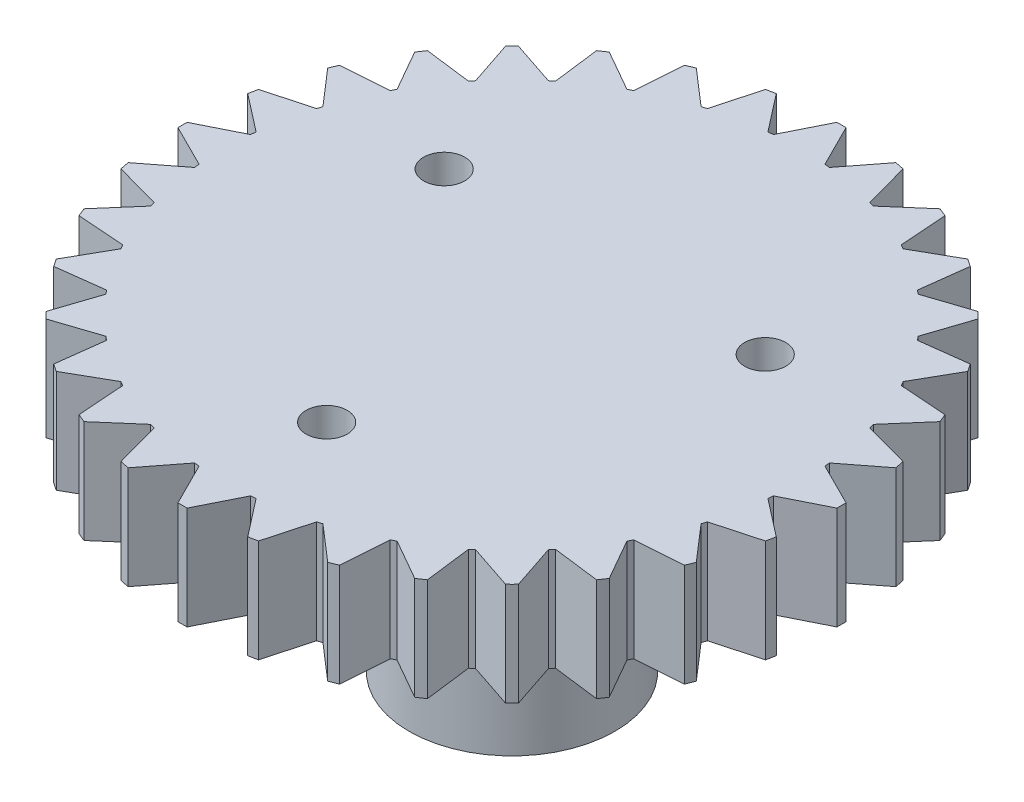
from build123d import *

# Parameters (mm, degrees)
BOSS_EXTRUDE1_DEPTH = 6.35
SKETCH2_OUTSIDE_W   = 55.65
SKETCH2_OUTSIDE_H   = 55.65
SKETCH2_OUTSIDE_R   = 20.32
CUT_EXTRUDE1_DEPTH  = 31.209342606
SKETCH3_R           = 6.35
BOSS_EXTRUDE2_DEPTH = 12.7
CUT_EXTRUDE3_DEPTH  = 2.54
SKETCH7_R           = 1.27
CUT_EXTRUDE4_DEPTH  = 33.527871126
CIRPATTERN2_COUNT   = 3


with BuildPart() as part:
    # Sketch1 → Boss-Extrude1 (new body)
    with BuildSketch(Plane(origin=(0, 0, 0), x_dir=(1, 0, 0), z_dir=(0, 1, 0))):
        with BuildLine():
            Line((0, 20.883987655), (1.5875, 17.708987655))
            ThreePointArc((1.5875, 17.708987655), (1.742744755, 17.69438444), (1.897855471, 17.678420309))
            Line((1.897855471, 17.678420309), (4.074263877, 20.482707688))
            Line((4.074263877, 20.482707688), (5.011848737, 17.059008536))
            ThreePointArc((5.011848737, 17.059008536), (5.161261562, 17.014399169), (5.310277422, 16.968481184))
            Line((5.310277422, 16.968481184), (7.991956077, 19.294288751))
            Line((7.991956077, 19.294288751), (8.243594937, 15.753461287))
            ThreePointArc((8.243594937, 15.753461287), (8.381433981, 15.68056008), (8.518628388, 15.606452844))
            Line((8.518628388, 15.606452844), (11.602521888, 17.364401118))
            Line((11.602521888, 17.364401118), (11.158544407, 13.842517355))
            ThreePointArc((11.158544407, 13.842517355), (11.279512592, 13.744125861), (11.399613243, 13.644677274))
            Line((11.399613243, 13.644677274), (14.767209289, 14.767209289))
            Line((14.767209289, 14.767209289), (13.644677274, 11.399613243))
            ThreePointArc((13.644677274, 11.399613243), (13.744125861, 11.279512592), (13.842517355, 11.158544407))
            Line((13.842517355, 11.158544407), (17.364401118, 11.602521888))
            Line((17.364401118, 11.602521888), (15.606452844, 8.518628388))
            ThreePointArc((15.606452844, 8.518628388), (15.68056008, 8.381433981), (15.753461287, 8.243594937))
            Line((15.753461287, 8.243594937), (19.294288751, 7.991956077))
            Line((19.294288751, 7.991956077), (16.968481184, 5.310277422))
            ThreePointArc((16.968481184, 5.310277422), (17.014399169, 5.161261562), (17.059008536, 5.011848737))
            Line((17.059008536, 5.011848737), (20.482707688, 4.074263877))
            Line((20.482707688, 4.074263877), (17.678420309, 1.897855471))
            ThreePointArc((17.678420309, 1.897855471), (17.69438444, 1.742744755), (17.708987655, 1.5875))
            Line((17.708987655, 1.5875), (20.883987655, 0))
            Line((20.883987655, 0), (17.708987655, -1.5875))
            ThreePointArc((17.708987655, -1.5875), (17.69438444, -1.742744755), (17.678420309, -1.897855471))
            Line((17.678420309, -1.897855471), (20.482707688, -4.074263877))
            Line((20.482707688, -4.074263877), (17.059008536, -5.011848737))
            ThreePointArc((17.059008536, -5.011848737), (17.014399169, -5.161261562), (16.968481184, -5.310277422))
            Line((16.968481184, -5.310277422), (19.294288751, -7.991956077))
            Line((19.294288751, -7.991956077), (15.753461287, -8.243594937))
            ThreePointArc((15.753461287, -8.243594937), (15.68056008, -8.381433981), (15.606452844, -8.518628388))
            Line((15.606452844, -8.518628388), (17.364401118, -11.602521888))
            Line((17.364401118, -11.602521888), (13.842517355, -11.158544407))
            ThreePointArc((13.842517355, -11.158544407), (13.744125861, -11.279512592), (13.644677274, -11.399613243))
            Line((13.644677274, -11.399613243), (14.767209289, -14.767209289))
            Line((14.767209289, -14.767209289), (11.399613243, -13.644677274))
            ThreePointArc((11.399613243, -13.644677274), (11.279512592, -13.744125861), (11.158544407, -13.842517355))
            Line((11.158544407, -13.842517355), (11.602521888, -17.364401118))
            Line((11.602521888, -17.364401118), (8.518628388, -15.606452844))
            ThreePointArc((8.518628388, -15.606452844), (8.381433981, -15.68056008), (8.243594937, -15.753461287))
            Line((8.243594937, -15.753461287), (7.991956077, -19.294288751))
            Line((7.991956077, -19.294288751), (5.310277422, -16.968481184))
            ThreePointArc((5.310277422, -16.968481184), (5.161261562, -17.014399169), (5.011848737, -17.059008536))
            Line((5.011848737, -17.059008536), (4.074263877, -20.482707688))
            Line((4.074263877, -20.482707688), (1.897855471, -17.678420309))
            ThreePointArc((1.897855471, -17.678420309), (1.742744755, -17.69438444), (1.5875, -17.708987655))
            Line((1.5875, -17.708987655), (0, -20.883987655))
            Line((0, -20.883987655), (-1.5875, -17.708987655))
            ThreePointArc((-1.5875, -17.708987655), (-1.742744755, -17.69438444), (-1.897855471, -17.678420309))
            Line((-1.897855471, -17.678420309), (-4.074263877, -20.482707688))
            Line((-4.074263877, -20.482707688), (-5.011848737, -17.059008536))
            ThreePointArc((-5.011848737, -17.059008536), (-5.161261562, -17.014399169), (-5.310277422, -16.968481184))
            Line((-5.310277422, -16.968481184), (-7.991956077, -19.294288751))
            Line((-7.991956077, -19.294288751), (-8.243594937, -15.753461287))
            ThreePointArc((-8.243594937, -15.753461287), (-8.381433981, -15.68056008), (-8.518628388, -15.606452844))
            Line((-8.518628388, -15.606452844), (-11.602521888, -17.364401118))
            Line((-11.602521888, -17.364401118), (-11.158544407, -13.842517355))
            ThreePointArc((-11.158544407, -13.842517355), (-11.279512592, -13.744125861), (-11.399613243, -13.644677274))
            Line((-11.399613243, -13.644677274), (-14.767209289, -14.767209289))
            Line((-14.767209289, -14.767209289), (-13.644677274, -11.399613243))
            ThreePointArc((-13.644677274, -11.399613243), (-13.744125861, -11.279512592), (-13.842517355, -11.158544407))
            Line((-13.842517355, -11.158544407), (-17.364401118, -11.602521888))
            Line((-17.364401118, -11.602521888), (-15.606452844, -8.518628388))
            ThreePointArc((-15.606452844, -8.518628388), (-15.68056008, -8.381433981), (-15.753461287, -8.243594937))
            Line((-15.753461287, -8.243594937), (-19.294288751, -7.991956077))
            Line((-19.294288751, -7.991956077), (-16.968481184, -5.310277422))
            ThreePointArc((-16.968481184, -5.310277422), (-17.014399169, -5.161261562), (-17.059008536, -5.011848737))
            Line((-17.059008536, -5.011848737), (-20.482707688, -4.074263877))
            Line((-20.482707688, -4.074263877), (-17.678420309, -1.897855471))
            ThreePointArc((-17.678420309, -1.897855471), (-17.69438444, -1.742744755), (-17.708987655, -1.5875))
            Line((-17.708987655, -1.5875), (-20.883987655, 0))
            Line((-20.883987655, 0), (-17.708987655, 1.5875))
            ThreePointArc((-17.708987655, 1.5875), (-17.69438444, 1.742744755), (-17.678420309, 1.897855471))
            Line((-17.678420309, 1.897855471), (-20.482707688, 4.074263877))
            Line((-20.482707688, 4.074263877), (-17.059008536, 5.011848737))
            ThreePointArc((-17.059008536, 5.011848737), (-17.014399169, 5.161261562), (-16.968481184, 5.310277422))
            Line((-16.968481184, 5.310277422), (-19.294288751, 7.991956077))
            Line((-19.294288751, 7.991956077), (-15.753461287, 8.243594937))
            ThreePointArc((-15.753461287, 8.243594937), (-15.68056008, 8.381433981), (-15.606452844, 8.518628388))
            Line((-15.606452844, 8.518628388), (-17.364401118, 11.602521888))
            Line((-17.364401118, 11.602521888), (-13.842517355, 11.158544407))
            ThreePointArc((-13.842517355, 11.158544407), (-13.744125861, 11.279512592), (-13.644677274, 11.399613243))
            Line((-13.644677274, 11.399613243), (-14.767209289, 14.767209289))
            Line((-14.767209289, 14.767209289), (-11.399613243, 13.644677274))
            ThreePointArc((-11.399613243, 13.644677274), (-11.279512592, 13.744125861), (-11.158544407, 13.842517355))
            Line((-11.158544407, 13.842517355), (-11.602521888, 17.364401118))
            Line((-11.602521888, 17.364401118), (-8.518628388, 15.606452844))
            ThreePointArc((-8.518628388, 15.606452844), (-8.381433981, 15.68056008), (-8.243594937, 15.753461287))
            Line((-8.243594937, 15.753461287), (-7.991956077, 19.294288751))
            Line((-7.991956077, 19.294288751), (-5.310277422, 16.968481184))
            ThreePointArc((-5.310277422, 16.968481184), (-5.161261562, 17.014399169), (-5.011848737, 17.059008536))
            Line((-5.011848737, 17.059008536), (-4.074263877, 20.482707688))
            Line((-4.074263877, 20.482707688), (-1.897855471, 17.678420309))
            ThreePointArc((-1.897855471, 17.678420309), (-1.742744755, 17.69438444), (-1.5875, 17.708987655))
            Line((-1.5875, 17.708987655), (0, 20.883987655))
        make_face()
    extrude(amount=BOSS_EXTRUDE1_DEPTH)

    # Sketch2 outside → Cut-Extrude1 (cut, through all)
    with BuildSketch(Plane(origin=(0, 6.35, 0), x_dir=(-1, 0, 0), z_dir=(0, 1, 0))):
        Rectangle(SKETCH2_OUTSIDE_W, SKETCH2_OUTSIDE_H)
        Circle(SKETCH2_OUTSIDE_R, mode=Mode.SUBTRACT)
    extrude(amount=-CUT_EXTRUDE1_DEPTH, mode=Mode.SUBTRACT)

    # Sketch3 → Boss-Extrude2 (add)
    with BuildSketch(Plane.XZ):
        with Locations(Location((0, 0, 0), (0, 0, 90))):
            Circle(SKETCH3_R)
    extrude(amount=BOSS_EXTRUDE2_DEPTH)

    # Sketch4 → Cut-Extrude3 (cut)
    with BuildSketch(Plane.XZ):
        Polygon((3.666174209, 11.43), (1.833087105, 14.605), (-1.833087105, 14.605), (-3.666174209, 11.43), (-1.833087105, 8.255), (1.833087105, 8.255), align=None)
    cut_extrude3 = extrude(amount=-CUT_EXTRUDE3_DEPTH, mode=Mode.SUBTRACT)

    # Sketch7 → Cut-Extrude4 (cut, through all)
    with BuildSketch(Plane.XZ.offset(-2.54)):
        with Locations(Location((0, 11.43, 0), (0, 0, 270))):
            Circle(SKETCH7_R)
    cut_extrude4 = extrude(amount=-CUT_EXTRUDE4_DEPTH, mode=Mode.SUBTRACT)

    # CirPattern2: Cut-Extrude3, Cut-Extrude4 ×3 about axis
    cirpattern2_axis = Axis((0, 0, 0), (0, 1, 0))
    add([cut_extrude3.rotate(cirpattern2_axis, i * 360 / CIRPATTERN2_COUNT) for i in range(1, CIRPATTERN2_COUNT)], mode=Mode.SUBTRACT)
    add([cut_extrude4.rotate(cirpattern2_axis, i * 360 / CIRPATTERN2_COUNT) for i in range(1, CIRPATTERN2_COUNT)], mode=Mode.SUBTRACT)


solid = part.part
